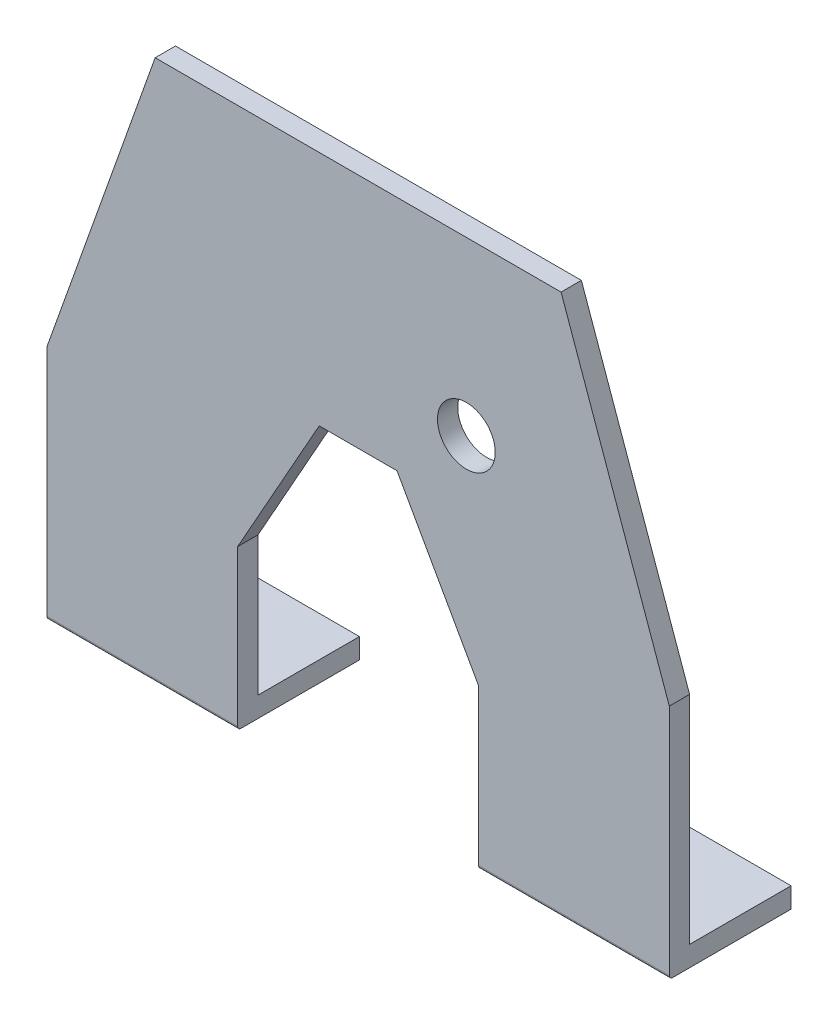
from build123d import *

# Parameters (mm, degrees)
CROQUIS1_R              = 4.271780476
SALIENTE_EXTRUIR1_DEPTH = 3
CROQUIS2_W              = 28.196158727
CROQUIS2_H              = 3
SALIENTE_EXTRUIR2_DEPTH = 15
REDONDEO1_R             = 0.5


with BuildPart() as part:
    # Croquis1 → Saliente-Extruir1 (new body)
    with BuildSketch(Plane.XY):
        Polygon((-46, -40), (-46, -5), (-30, 40), (30, 40), (46, -5), (46, -40), (17.803841273, -40), (17.803841273, -16.484284277), (5.75, 5), (-5.75, 5), (-17.803841273, -16.484284277), (-17.803841273, -40), align=None)
        with Locations((16, 14.6)):
            Circle(CROQUIS1_R, mode=Mode.SUBTRACT)
    extrude(amount=SALIENTE_EXTRUIR1_DEPTH)

    # Croquis2 → Saliente-Extruir2 (add)
    with BuildSketch(Plane(origin=(0, 0, 0), x_dir=(-1, 0, 0), z_dir=(0, 0, -1))):
        with Locations((-31.901920637, -38.5)):
            Rectangle(CROQUIS2_W, CROQUIS2_H)
        with Locations((31.901920637, -38.5)):
            Rectangle(CROQUIS2_W, CROQUIS2_H)
    extrude(amount=SALIENTE_EXTRUIR2_DEPTH)

    # Redondeo1
    redondeo1_edges = [part.edges().sort_by_distance(p)[0] for p in [
        (-31.901920636, -40, 3),
        (31.901920636, -40, 3),
    ]]
    fillet(redondeo1_edges, radius=REDONDEO1_R)


solid = part.part
